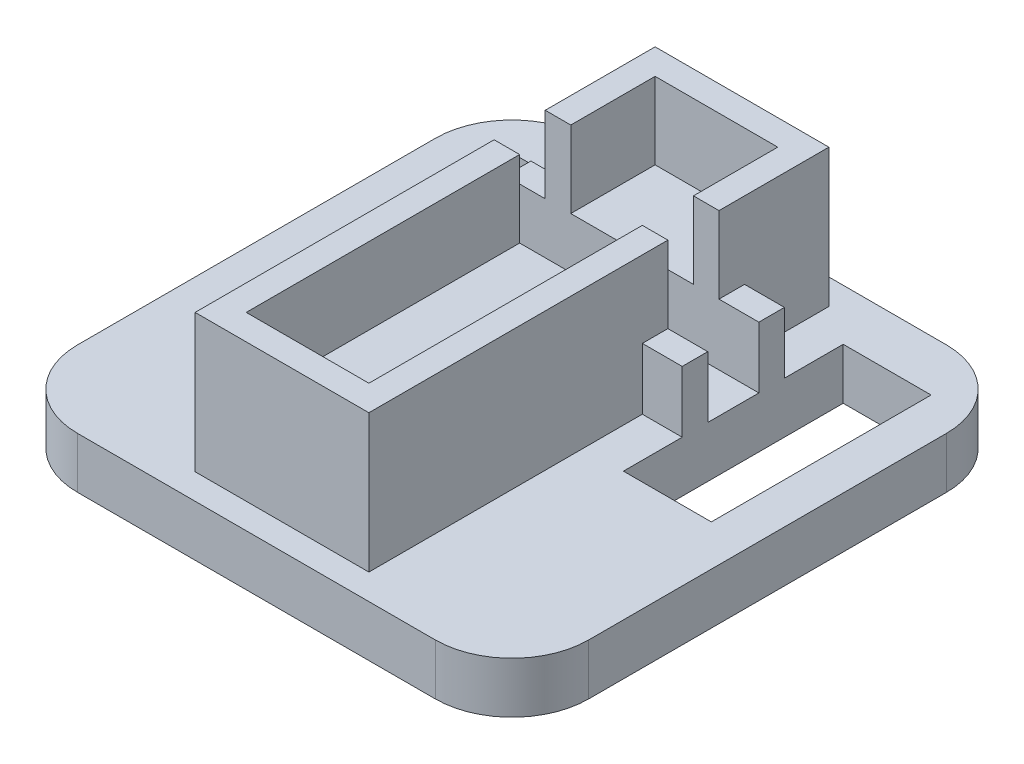
from build123d import *

# Parameters (mm, degrees)
BOSS_EXTRUDE1_DEPTH = 10
SKETCH3_W           = 17.2
SKETCH3_H           = 43
CUT_EXTRUDE1_DEPTH  = 72.414284285
SKETCH5_W           = 49.6
SKETCH5_H           = 5
BOSS_EXTRUDE3_DEPTH = 12
BOSS_EXTRUDE2_START = -12
SKETCH2_W           = 34
SKETCH2_H           = 90
SKETCH2_W_2         = 24
SKETCH2_H_2         = 80
BOSS_EXTRUDE2_DEPTH = 27
SKETCH6_W           = 5
SKETCH6_H           = 10
CUT_EXTRUDE2_DEPTH  = 27
SKETCH8_W           = 24
SKETCH8_H           = 48.5
SKETCH8_H_2         = 11.5
BOSS_EXTRUDE4_DEPTH = 12


with BuildPart() as part:
    # Sketch1 → Boss-Extrude1 (new body)
    with BuildSketch(Plane(origin=(0, 0, 0), x_dir=(1, 0, 0), z_dir=(0, 1, 0))):
        with BuildLine():
            Line((-35, 50), (35, 50))
            ThreePointArc((35, 50), (45.606601718, 45.606601718), (50, 35))
            Line((50, 35), (50, -35))
            ThreePointArc((50, -35), (45.606601718, -45.606601718), (35, -50))
            Line((35, -50), (-35, -50))
            ThreePointArc((-35, -50), (-45.606601718, -45.606601718), (-50, -35))
            Line((-50, -35), (-50, 35))
            ThreePointArc((-50, 35), (-45.606601718, 45.606601718), (-35, 50))
        make_face()
    extrude(amount=BOSS_EXTRUDE1_DEPTH)

    # Sketch3 → Cut-Extrude1 (cut, through all)
    with BuildSketch(Plane(origin=(0, 10, 0), x_dir=(1, 0, 0), z_dir=(0, 1, 0))):
        with Locations((-33.4, 18.5)):
            Rectangle(SKETCH3_W, SKETCH3_H)
        with Locations((33.4, 18.5)):
            Rectangle(SKETCH3_W, SKETCH3_H)
    extrude(amount=-CUT_EXTRUDE1_DEPTH, mode=Mode.SUBTRACT)

    # Sketch5 → Boss-Extrude3 (add)
    with BuildSketch(Plane(origin=(0, 10, 0), x_dir=(1, 0, 0), z_dir=(0, 1, 0))):
        with Locations((0, 11)):
            Rectangle(SKETCH5_W, SKETCH5_H)
        with Locations((0, 26)):
            Rectangle(SKETCH5_W, SKETCH5_H)
    extrude(amount=BOSS_EXTRUDE3_DEPTH)

    # Sketch2 → Boss-Extrude2 (add)
    with BuildSketch(Plane(origin=(0, 22, 0), x_dir=(1, 0, 0), z_dir=(0, 1, 0)).offset(BOSS_EXTRUDE2_START)):
        Rectangle(SKETCH2_W, SKETCH2_H)
        Rectangle(SKETCH2_W_2, SKETCH2_H_2, mode=Mode.SUBTRACT)
    extrude(amount=BOSS_EXTRUDE2_DEPTH)

    # Sketch6 → Cut-Extrude2 (cut)
    with BuildSketch(Plane(origin=(0, 37, 0), x_dir=(1, 0, 0), z_dir=(0, 1, 0))):
        with Locations((-14.5, 18.5)):
            Rectangle(SKETCH6_W, SKETCH6_H)
        with Locations((14.5, 18.5)):
            Rectangle(SKETCH6_W, SKETCH6_H)
    extrude(amount=-CUT_EXTRUDE2_DEPTH, mode=Mode.SUBTRACT)

    # Sketch8 → Boss-Extrude4 (add)
    with BuildSketch(Plane(origin=(0, 10, 0), x_dir=(1, 0, 0), z_dir=(0, 1, 0))):
        with Locations((0, -15.75)):
            Rectangle(SKETCH8_W, SKETCH8_H)
        with Locations((0, 34.25)):
            Rectangle(SKETCH8_W, SKETCH8_H_2)
    extrude(amount=BOSS_EXTRUDE4_DEPTH)


solid = part.part
